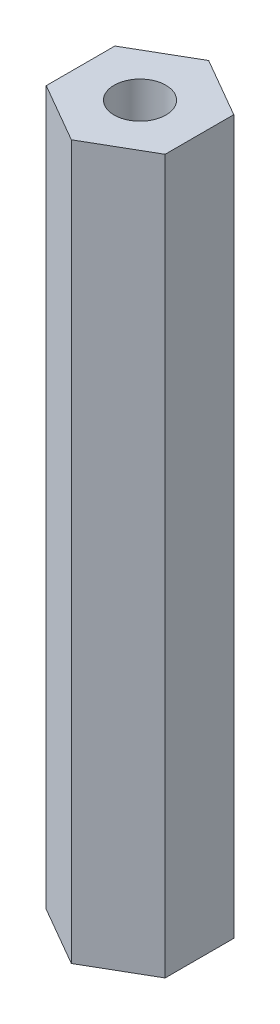
from build123d import *

# Parameters (mm, degrees)
BOSS_EXTRUDE1_DEPTH   = 47.625
F_8_32_TAPPED_HOLE1_D = 3.4544


with BuildPart() as part:
    # Sketch1 → Boss-Extrude1 (new body)
    with BuildSketch(Plane(origin=(0, 0, 0), x_dir=(1, 0, 0), z_dir=(0, 1, 0))):
        Polygon((0, 4.582717762), (-3.96875, 2.291358881), (-3.96875, -2.291358881), (0, -4.582717762), (3.96875, -2.291358881), (3.96875, 2.291358881), align=None)
    extrude(amount=BOSS_EXTRUDE1_DEPTH)

    # #8-32 Tapped Hole1 (through all)
    with Locations(Plane(origin=(0, 47.625, 0), x_dir=(-1, 0, 0), z_dir=(0, 1, 0))):
        with Locations((0, 0)):
            Hole(F_8_32_TAPPED_HOLE1_D / 2)


solid = part.part
